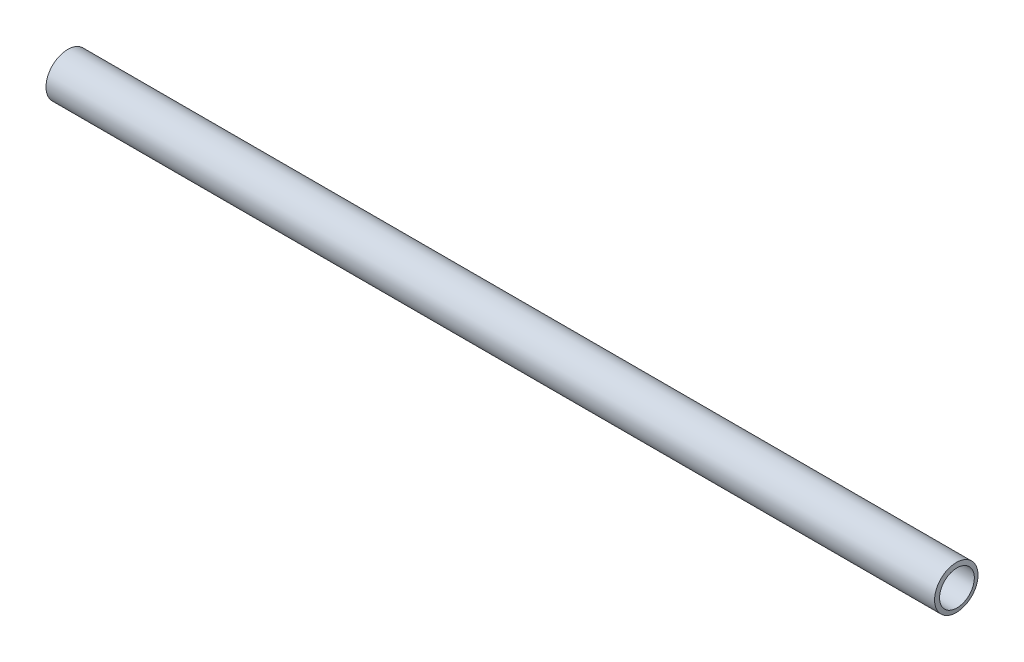
from build123d import *


with BuildPart() as part:
    # Sketch1 → Revolve1 (revolve)
    with BuildSketch(Plane.XY):
        with BuildLine():
            ThreePointArc((-0.680370764, 10.16), (-0.86237352, 11.431624398), (-1.065786755, 12.7))
            Line((-1.065786755, 12.7), (-520.7, 12.7))
            Line((-520.7, 12.7), (-520.7, 10.16))
            Line((-520.7, 10.16), (-0.680370764, 10.16))
        make_face()
    revolve(axis=Axis((-266.7, 0, 0), (-1, 0, 0)))


solid = part.part
